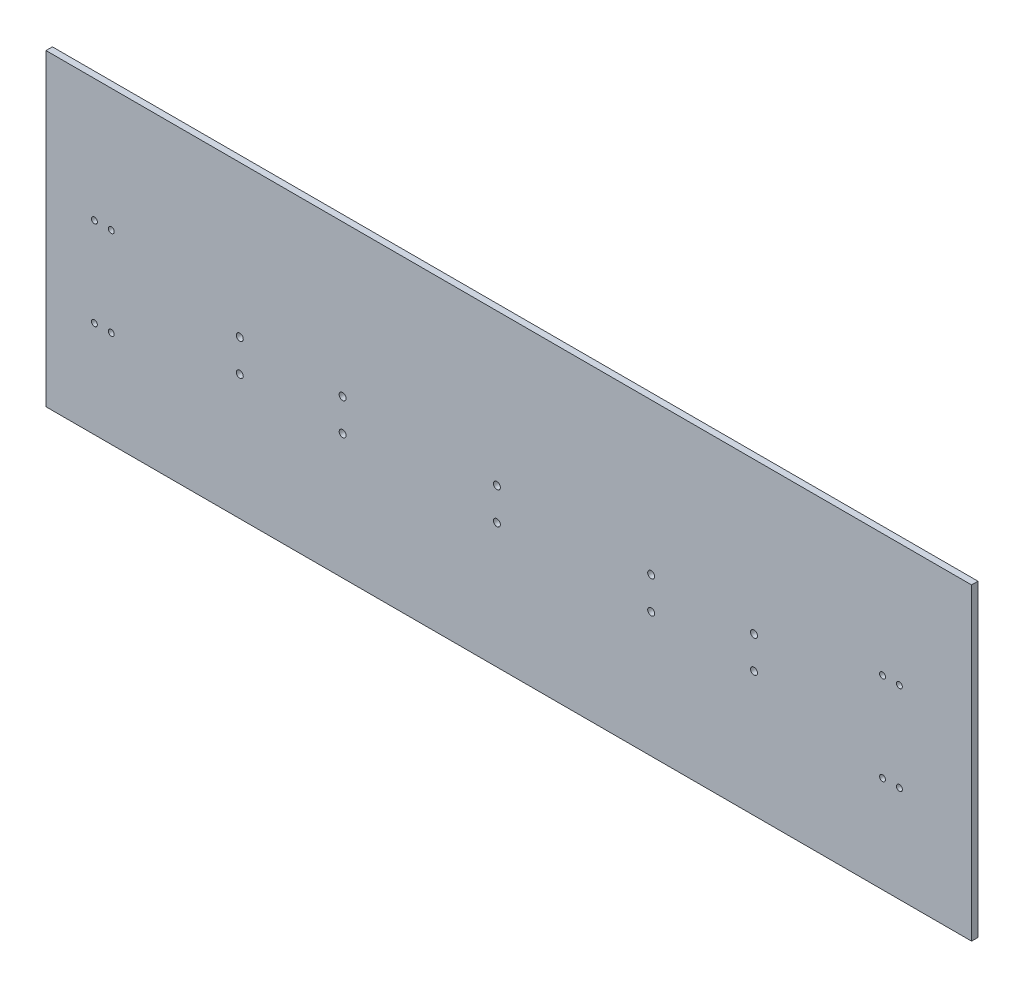
from build123d import *

# Parameters (mm, degrees)
SKETCH1_W           = 914.4
SKETCH1_H           = 304.8
SKETCH1_R           = 3.429
SKETCH1_R_2         = 2.921
BOSS_EXTRUDE1_DEPTH = 6.35


with BuildPart() as part:
    # Sketch1 → Boss-Extrude1 (new body)
    with BuildSketch(Plane.XY):
        with Locations((457.2, 152.4)):
            Rectangle(SKETCH1_W, SKETCH1_H)
        with Locations((445.453955885, 155.343145215)):
            Circle(SKETCH1_R, mode=Mode.SUBTRACT)
        with Locations((445.453955885, 123.593145215)):
            Circle(SKETCH1_R, mode=Mode.SUBTRACT)
        with Locations((597.853955885, 155.343145215)):
            Circle(SKETCH1_R, mode=Mode.SUBTRACT)
        with Locations((597.853955885, 123.593145215)):
            Circle(SKETCH1_R, mode=Mode.SUBTRACT)
        with Locations((699.453955885, 155.343145215)):
            Circle(SKETCH1_R, mode=Mode.SUBTRACT)
        with Locations((699.453955885, 123.593145215)):
            Circle(SKETCH1_R, mode=Mode.SUBTRACT)
        with Locations((293.053955885, 155.343145215)):
            Circle(SKETCH1_R, mode=Mode.SUBTRACT)
        with Locations((293.053955885, 123.593145215)):
            Circle(SKETCH1_R, mode=Mode.SUBTRACT)
        with Locations((191.453955885, 155.343145215)):
            Circle(SKETCH1_R, mode=Mode.SUBTRACT)
        with Locations((191.453955885, 123.593145215)):
            Circle(SKETCH1_R, mode=Mode.SUBTRACT)
        with Locations((47.816955885, 183.410145215)):
            Circle(SKETCH1_R_2, mode=Mode.SUBTRACT)
        with Locations((64.453955885, 183.410145215)):
            Circle(SKETCH1_R_2, mode=Mode.SUBTRACT)
        with Locations((47.816955885, 95.526145215)):
            Circle(SKETCH1_R_2, mode=Mode.SUBTRACT)
        with Locations((64.453955885, 95.526145215)):
            Circle(SKETCH1_R_2, mode=Mode.SUBTRACT)
        with Locations((826.453955885, 183.410145215)):
            Circle(SKETCH1_R_2, mode=Mode.SUBTRACT)
        with Locations((843.090955885, 183.410145215)):
            Circle(SKETCH1_R_2, mode=Mode.SUBTRACT)
        with Locations((826.453955885, 95.526145215)):
            Circle(SKETCH1_R_2, mode=Mode.SUBTRACT)
        with Locations((843.090955885, 95.526145215)):
            Circle(SKETCH1_R_2, mode=Mode.SUBTRACT)
    extrude(amount=BOSS_EXTRUDE1_DEPTH)


solid = part.part
